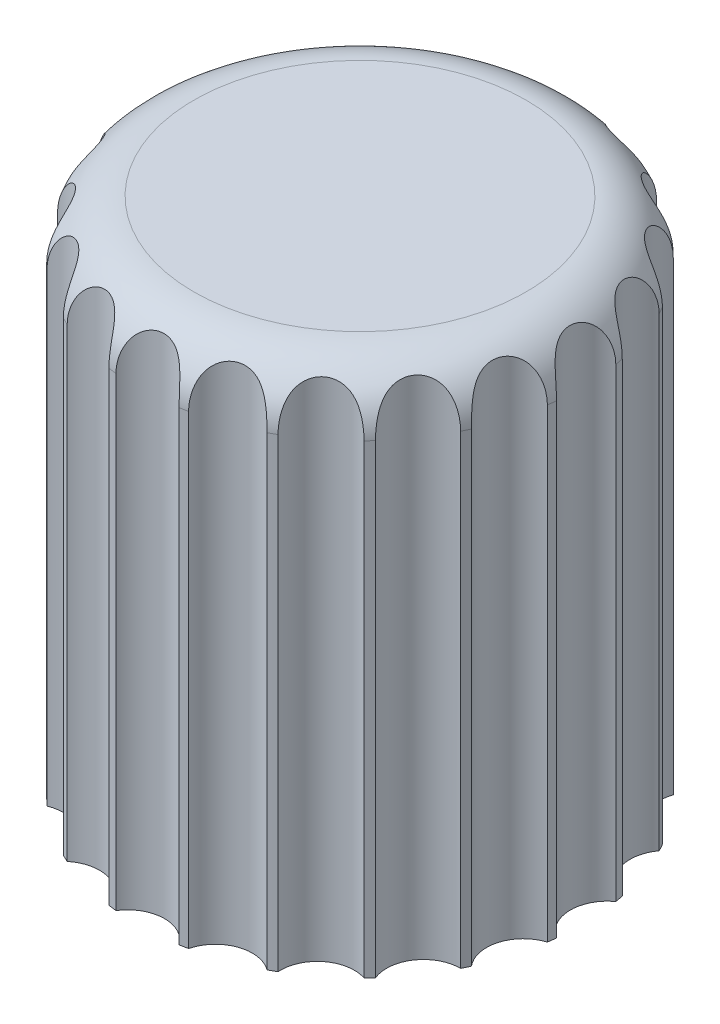
from build123d import *

# Parameters (mm, degrees)
SKETCH1_R           = 6
SKETCH1_R_2         = 5.25
SKETCH1_W           = 0.8
SKETCH1_H           = 11.973303638
BOSS_EXTRUDE1_DEPTH = 12.1
SKETCH4_R           = 6
BOSS_EXTRUDE2_DEPTH = 2
FILLET1_R           = 1.5
SKETCH7_R           = 1
CUT_EXTRUDE6_DEPTH  = 25


with BuildPart() as part:
    # Sketch1 → Boss-Extrude1 (new body)
    # profile 1 of 2: a face of its own
    with BuildSketch(Plane(origin=(0, 0, 0), x_dir=(1, 0, 0), z_dir=(0, 1, 0))):
        with Locations(Location((0, 0, 0), (0, 0, 270))):
            Circle(SKETCH1_R)
        Circle(SKETCH1_R_2, mode=Mode.SUBTRACT)
    # profile 2 of 2: a face of its own
    with BuildSketch(Plane(origin=(0, 0, 0), x_dir=(1, 0, 0), z_dir=(0, 1, 0))):
        Rectangle(SKETCH1_W, SKETCH1_H)
    extrude(amount=BOSS_EXTRUDE1_DEPTH)

    # Sketch4 → Boss-Extrude2 (add)
    with BuildSketch(Plane(origin=(0, 12.1, 0), x_dir=(1, 0, 0), z_dir=(0, 1, 0))):
        with Locations(Location((0, 0, 0), (0, 0, 270))):
            Circle(SKETCH4_R)
    extrude(amount=BOSS_EXTRUDE2_DEPTH)

    # Fillet1
    fillet1_edges = [part.edges().sort_by_distance(p)[0] for p in [
        (0, 14.1, -6),
    ]]
    fillet(fillet1_edges, radius=FILLET1_R)

    # Sketch7 → Cut-Extrude6 (cut)
    with BuildSketch(Plane(origin=(0, 14.1, 0), x_dir=(1, 0, 0), z_dir=(0, 1, 0))):
        with Locations((-6.241517499, 1.814789055)):
            Circle(SKETCH7_R)
        with Locations((-5.375235229, 3.654701934)):
            Circle(SKETCH7_R)
        with Locations((-3.982787484, 5.136867125)):
            Circle(SKETCH7_R)
        with Locations((-2.200476751, 6.11619997)):
            Circle(SKETCH7_R)
        with Locations((-0.202768021, 6.496836548)):
            Circle(SKETCH7_R)
        with Locations((1.814789055, 6.241517499)):
            Circle(SKETCH7_R)
        with Locations((3.654701934, 5.375235229)):
            Circle(SKETCH7_R)
        with Locations((5.136867125, 3.982787484)):
            Circle(SKETCH7_R)
        with Locations((6.11619997, 2.200476751)):
            Circle(SKETCH7_R)
        with Locations((6.496836548, 0.202768021)):
            Circle(SKETCH7_R)
        with Locations((6.241517499, -1.814789055)):
            Circle(SKETCH7_R)
        with Locations((5.375235229, -3.654701934)):
            Circle(SKETCH7_R)
        with Locations((3.982787484, -5.136867125)):
            Circle(SKETCH7_R)
        with Locations((2.200476751, -6.11619997)):
            Circle(SKETCH7_R)
        with Locations((0.202768021, -6.496836548)):
            Circle(SKETCH7_R)
        with Locations((-1.814789055, -6.241517499)):
            Circle(SKETCH7_R)
        with Locations((-3.654701934, -5.375235229)):
            Circle(SKETCH7_R)
        with Locations((-5.136867125, -3.982787484)):
            Circle(SKETCH7_R)
        with Locations((-6.11619997, -2.200476751)):
            Circle(SKETCH7_R)
        with Locations((-6.496836548, -0.202768021)):
            Circle(SKETCH7_R)
    extrude(amount=-CUT_EXTRUDE6_DEPTH, mode=Mode.SUBTRACT)


solid = part.part
